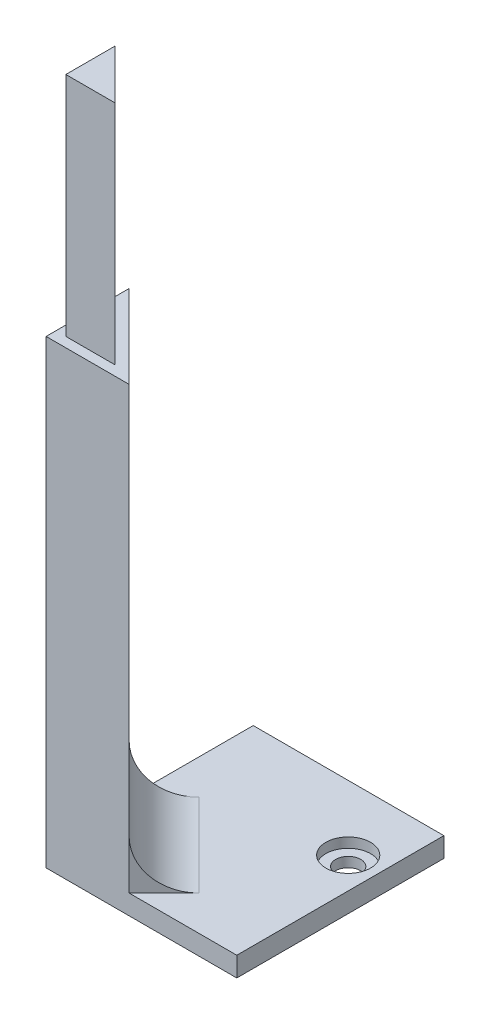
from build123d import *

# Parameters (mm, degrees)
BOSS_EXTRUDE3_DEPTH = 320
SKETCH8_W           = 15
SKETCH8_H           = 111
CUT_EXTRUDE4_DEPTH  = 321.702354216
BOSS_EXTRUDE5_DEPTH = 140
SKETCH4_W           = 58
SKETCH4_H           = 63
SKETCH4_R           = 3.8
BOSS_EXTRUDE4_DEPTH = 6
BOSS_EXTRUDE6_DEPTH = 15
CUT_EXTRUDE5_DEPTH  = 226.279401317
SKETCH12_R          = 6.8
CUT_EXTRUDE6_DEPTH  = 3


with BuildPart() as part:
    # Sketch1 → Boss-Extrude3 (new body)
    with BuildSketch(Plane(origin=(0, 0, 0), x_dir=(1, 0, 0), z_dir=(0, 1, 0))):
        Polygon((0, 0), (0, 15), (15, 0), align=None)
    extrude(amount=BOSS_EXTRUDE3_DEPTH)

    # Sketch8 → Cut-Extrude4 (cut, through all)
    with BuildSketch(Plane.XY):
        with Locations((7.5, 264.5)):
            Rectangle(SKETCH8_W, SKETCH8_H)
    extrude(amount=-CUT_EXTRUDE4_DEPTH, mode=Mode.SUBTRACT)

    # Sketch9 → Boss-Extrude5 (add)
    with BuildSketch(Plane.XZ):
        Polygon((-3, -22.242640687), (-3, 3), (22.242640687, 3), align=None)
    extrude(amount=-BOSS_EXTRUDE5_DEPTH)

    # Sketch4 → Boss-Extrude4 (add)
    with BuildSketch(Plane.XZ):
        with Locations((26, -28.5)):
            Rectangle(SKETCH4_W, SKETCH4_H)
        with Locations(Location((45.59, -40.3, 0), (0, 0, 270))):
            Circle(SKETCH4_R, mode=Mode.SUBTRACT)
    extrude(amount=-BOSS_EXTRUDE4_DEPTH)

    # Sketch10 → Boss-Extrude6 (add)
    with BuildSketch(Plane(origin=(0, 6, 0), x_dir=(1, 0, 0), z_dir=(0, 1, 0))):
        Polygon((-3, 22.242640687), (7.606601718, 32.849242405), (32.849242405, 7.606601718), (22.242640687, -3), align=None)
    extrude(amount=BOSS_EXTRUDE6_DEPTH)

    # Sketch11 → Cut-Extrude5 (cut, through all)
    with BuildSketch(Plane(origin=(12.621320344, 0, 12.621320344), x_dir=(0.7071067811865477, 0, -0.7071067811865475), z_dir=(0.7071067811865475, 0, 0.7071067811865477))):
        with BuildLine():
            Line((13.606601718, 21), (28.606601718, 21))
            Line((28.606601718, 21), (28.606601718, 6))
            ThreePointArc((28.606601718, 6), (18, 10.393398282), (13.606601718, 21))
        make_face()
    extrude(amount=-CUT_EXTRUDE5_DEPTH, mode=Mode.SUBTRACT)

    # Sketch12 → Cut-Extrude6 (cut)
    with BuildSketch(Plane(origin=(0, 6, 0), x_dir=(1, 0, 0), z_dir=(0, 1, 0))):
        with Locations(Location((45.59, 40.3, 0), (0, 0, 270))):
            Circle(SKETCH12_R)
    extrude(amount=-CUT_EXTRUDE6_DEPTH, mode=Mode.SUBTRACT)


solid = part.part
